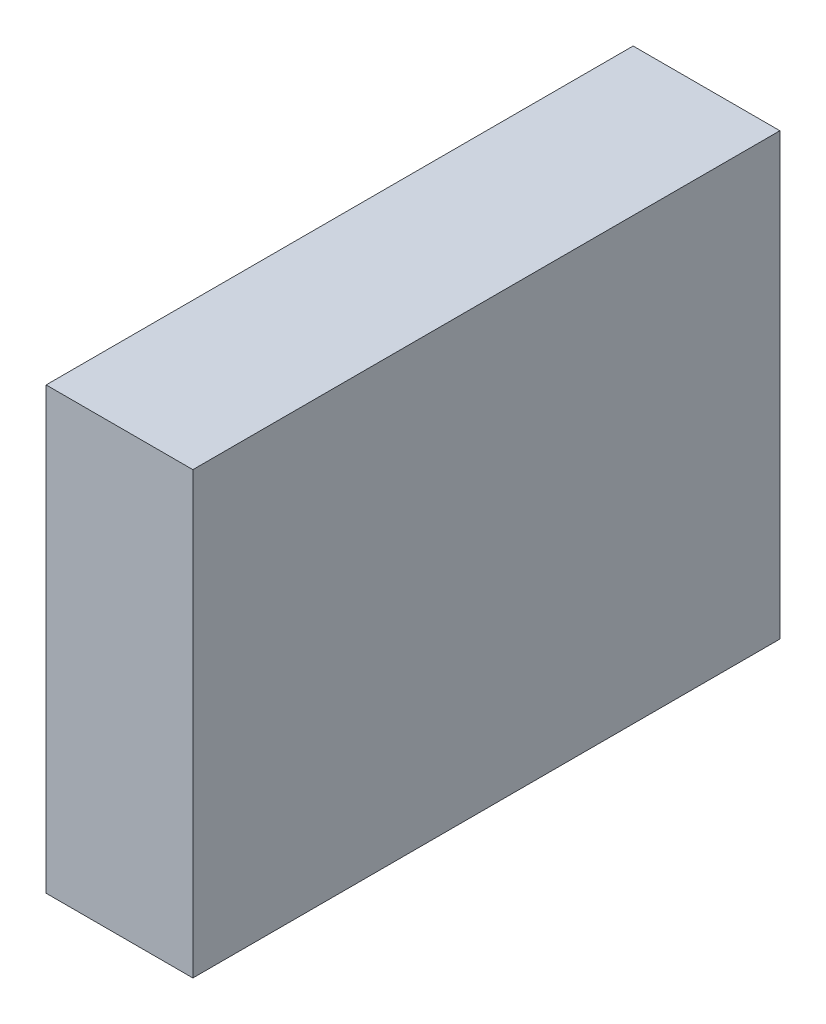
from build123d import *

# Parameters (mm, degrees)
SKETCH1_W           = 25.4
SKETCH1_H           = 76.2
BOSS_EXTRUDE1_DEPTH = 101.6


with BuildPart() as part:
    # Sketch1 → Boss-Extrude1 (new body)
    with BuildSketch(Plane.XY):
        with Locations((12.7, 38.1)):
            Rectangle(SKETCH1_W, SKETCH1_H)
    extrude(amount=BOSS_EXTRUDE1_DEPTH)


solid = part.part
